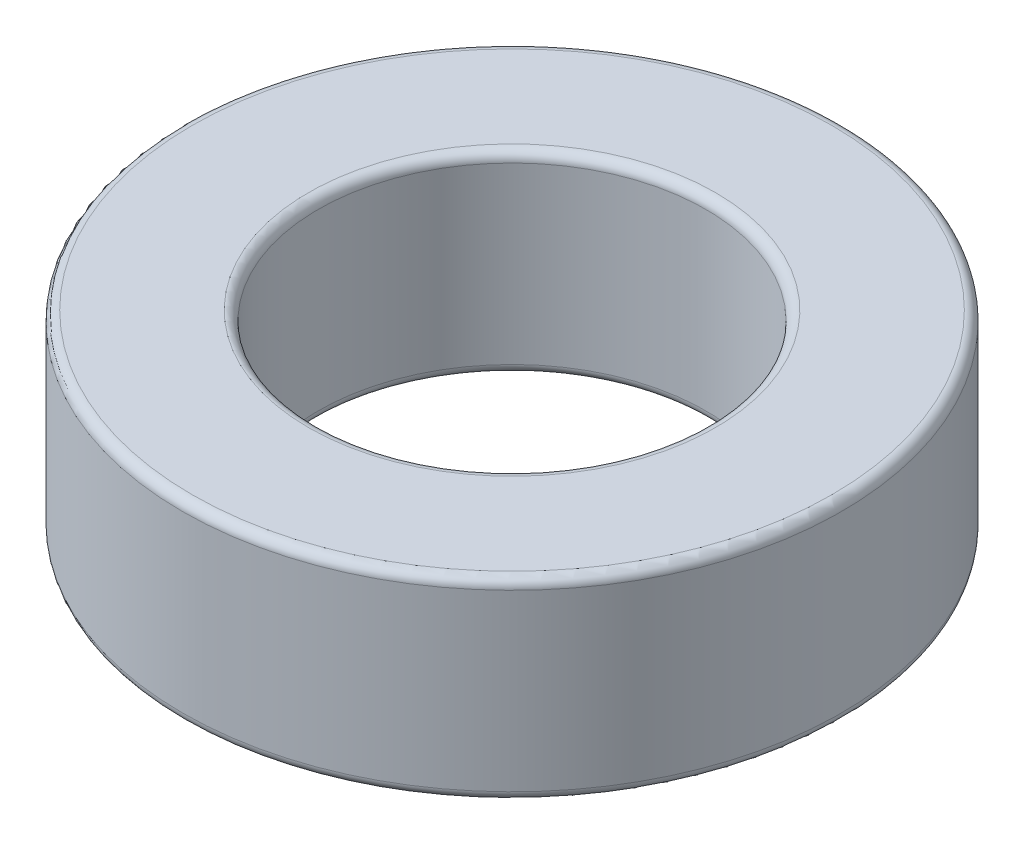
from build123d import *

# Parameters (mm, degrees)
SKETCH_1_R      = 8.5
SKETCH_1_R_2    = 5
EXTRUDE_1_DEPTH = 5
FILLET_1_R      = 0.25


with BuildPart() as part:
    # 草图1 → 凸台-拉伸1 (new body)
    with BuildSketch(Plane(origin=(0, 0, 0), x_dir=(1, 0, 0), z_dir=(0, 1, 0))):
        with Locations(Location((0, 0, 0), (0, 0, 270))):
            Circle(SKETCH_1_R)
        with Locations(Location((0, 0, 0), (0, 0, 270))):
            Circle(SKETCH_1_R_2, mode=Mode.SUBTRACT)
    extrude(amount=EXTRUDE_1_DEPTH)

    # 圆角1
    fillet_1_edges = [part.edges().sort_by_distance(p)[0] for p in [
        (0, 0, -8.5),
        (0, 5, -8.5),
        (0, 0, -5),
        (0, 5, -5),
    ]]
    fillet(fillet_1_edges, radius=FILLET_1_R)


solid = part.part
